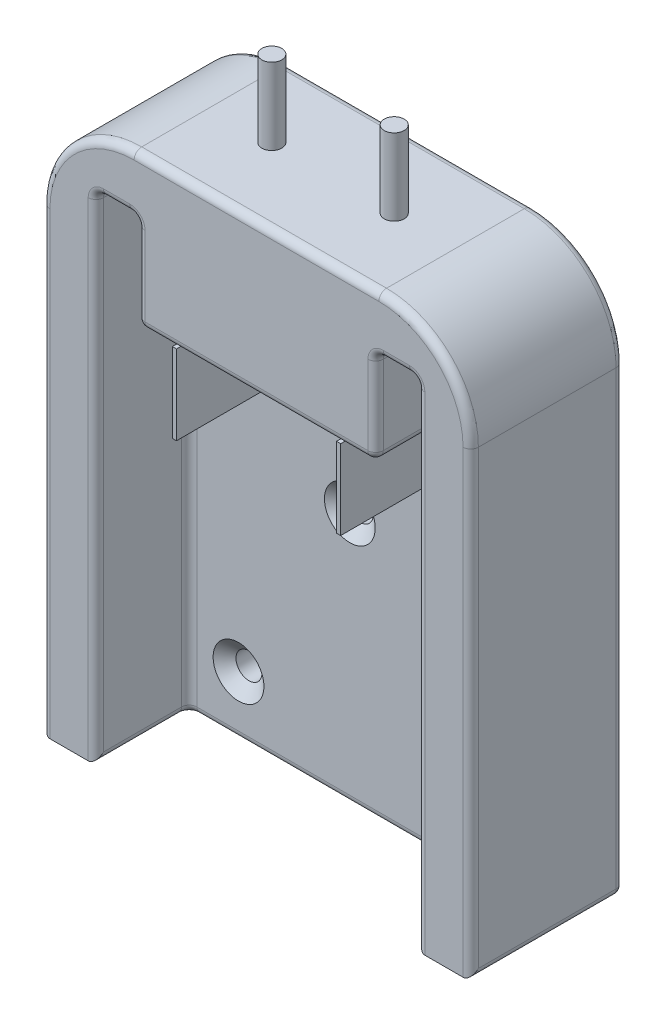
from build123d import *

# Parameters (mm, degrees)
SKETCH3_W                                 = 71.12
SKETCH3_H                                 = 91.44
BOSS_EXTRUDE1_DEPTH                       = 25.4
CUT_EXTRUDE1_DEPTH                        = 15.494
SKETCH7_W                                 = 0.6858
SKETCH7_H                                 = 13.208
BOSS_EXTRUDE2_DEPTH                       = 15.494
BOSS_EXTRUDE2_2_DEPTH                     = 15.494
CSK_FOR_8_FLAT_HEAD_MACHINE_SCREW_2_COUNT = 2
CSK_FOR_8_FLAT_HEAD_MACHINE_SCREW_2_PITCH = 36.95503603
CSK_FOR_8_FLAT_HEAD_MACHINE_SCREW_3_COUNT = 2
CSK_FOR_8_FLAT_HEAD_MACHINE_SCREW_3_PITCH = 36.95503603
FILLET1_R                                 = 15.24
FILLET2_R                                 = 1.27
SKETCH11_R                                = 1.651
BOSS_EXTRUDE3_DEPTH                       = 12.7
BOSS_EXTRUDE3_2_DEPTH                     = 12.7


with BuildPart() as part:
    # Sketch3 → Boss-Extrude1 (new body)
    with BuildSketch(Plane.XY):
        Rectangle(SKETCH3_W, SKETCH3_H)
    extrude(amount=BOSS_EXTRUDE1_DEPTH)

    # Sketch4 → Cut-Extrude1 (cut)
    with BuildSketch(Plane.XY.offset(25.4)):
        Polygon((-26.67, -45.72), (-26.67, 20.828), (-26.67, 36.5125), (-19.7739, 36.5125), (-19.7739, 20.828), (19.7739, 20.828), (19.7739, 36.5125), (26.67, 36.5125), (26.67, 20.828), (26.67, -45.72), align=None)
    extrude(amount=-CUT_EXTRUDE1_DEPTH, mode=Mode.SUBTRACT)

    # Sketch10 → CSK for #8 Flat Head Machine Screw (100)1 (revolve, cut)
    with BuildSketch(Plane(origin=(0, -3.9243, 9.906), x_dir=(0, -1, 0), z_dir=(1, 0, 0))):
        Polygon((0, 0), (0, 9.906), (2.15265, 9.906), (2.15265, 1.731691864), (4.2164, 0), align=None)
    csk_for_8_flat_head_machine_screw_100 = revolve(axis=Axis((0, -3.9243, 16.256), (0, 0, -1)), mode=Mode.SUBTRACT)

    # CSK for _8 Flat Head Machine Screw _ 2: CSK for #8 Flat Head Machine Screw (100)1 ×2
    with Locations(*[Vector(-0.5, -0.8660254037844387, 0) * (i * CSK_FOR_8_FLAT_HEAD_MACHINE_SCREW_2_PITCH) for i in range(1, CSK_FOR_8_FLAT_HEAD_MACHINE_SCREW_2_COUNT)]):
        add(csk_for_8_flat_head_machine_screw_100, mode=Mode.SUBTRACT)

    # CSK for _8 Flat Head Machine Screw _ 3: CSK for #8 Flat Head Machine Screw (100)1 ×2
    with Locations(*[Vector(0.5, -0.8660254037844387, 0) * (i * CSK_FOR_8_FLAT_HEAD_MACHINE_SCREW_3_PITCH) for i in range(1, CSK_FOR_8_FLAT_HEAD_MACHINE_SCREW_3_COUNT)]):
        add(csk_for_8_flat_head_machine_screw_100, mode=Mode.SUBTRACT)

    # Fillet1
    fillet1_edges = [part.edges().sort_by_distance(p)[0] for p in [
        (-35.56, 45.72, 12.7),
        (35.56, 45.72, 12.7),
    ]]
    fillet(fillet1_edges, radius=FILLET1_R)

    # Fillet2
    fillet2_edges = [part.edges().sort_by_distance(p)[0] for p in [
        (35.56, -7.62, 25.4),
        (-19.7739, 36.5125, 17.653),
        (-19.7739, 28.67025, 25.4),
        (-19.7739, 20.828, 17.653),
        (0, 20.828, 25.4),
        (19.7739, 28.67025, 9.906),
        (19.7739, 20.828, 17.653),
        (23.22195, 36.5125, 9.906),
        (19.7739, 36.5125, 17.653),
        (26.67, 36.5125, 17.653),
        (26.67, -4.60375, 25.4),
        (0, -45.72, 9.906),
        (26.67, -45.72, 17.653),
        (-26.67, -45.72, 17.653),
        (-26.67, -4.60375, 25.4),
        (-26.67, 36.5125, 17.653),
        (-23.22195, 36.5125, 25.4),
        (23.22195, 36.5125, 25.4),
        (19.7739, 28.67025, 25.4),
        (-23.22195, 36.5125, 9.906),
        (-19.7739, 28.67025, 9.906),
        (0, 20.828, 9.906),
        (26.67, -4.60375, 9.906),
        (-26.67, -4.60375, 9.906),
        (35.56, -7.62, 0),
        (0, -45.72, 0),
        (0, 45.72, 0),
        (0, 45.72, 25.4),
        (-35.56, -7.62, 0),
        (-31.096307345, 41.256307345, 0),
        (31.096307345, 41.256307345, 0),
        (-35.56, -7.62, 25.4),
        (-31.096307345, 41.256307345, 25.4),
        (31.096307345, 41.256307345, 25.4),
        (35.56, -45.72, 12.7),
        (-35.56, -45.72, 12.7),
    ]]
    fillet(fillet2_edges, radius=FILLET2_R)


with BuildPart() as body_2:
    # Sketch7 → Boss-Extrude2 (new body)
    with BuildSketch(Plane.XY.offset(25.4)):
        with Locations((13.6271, 14.224)):
            Rectangle(SKETCH7_W, SKETCH7_H)
    extrude(amount=-BOSS_EXTRUDE2_DEPTH)


with BuildPart() as body_3:
    # Sketch7 → Boss-Extrude2 2 (new body)
    with BuildSketch(Plane.XY.offset(25.4)):
        with Locations((-13.6271, 14.224)):
            Rectangle(SKETCH7_W, SKETCH7_H)
    extrude(amount=-BOSS_EXTRUDE2_2_DEPTH)


with BuildPart() as body_4:
    # Sketch11 → Boss-Extrude3 (new body)
    with BuildSketch(Plane(origin=(0, 45.72, 0), x_dir=(1, 0, 0), z_dir=(0, 1, 0))):
        with Locations(Location((-10.16, -12.7, 0), (0, 0, 180))):
            Circle(SKETCH11_R)
    extrude(amount=BOSS_EXTRUDE3_DEPTH)


with BuildPart() as body_5:
    # Sketch11 → Boss-Extrude3 2 (new body)
    with BuildSketch(Plane(origin=(0, 45.72, 0), x_dir=(1, 0, 0), z_dir=(0, 1, 0))):
        with Locations(Location((10.16, -12.7, 0), (0, 0, 180))):
            Circle(SKETCH11_R)
    extrude(amount=BOSS_EXTRUDE3_2_DEPTH)


solid = Compound([part.part, body_2.part, body_3.part, body_4.part, body_5.part])
